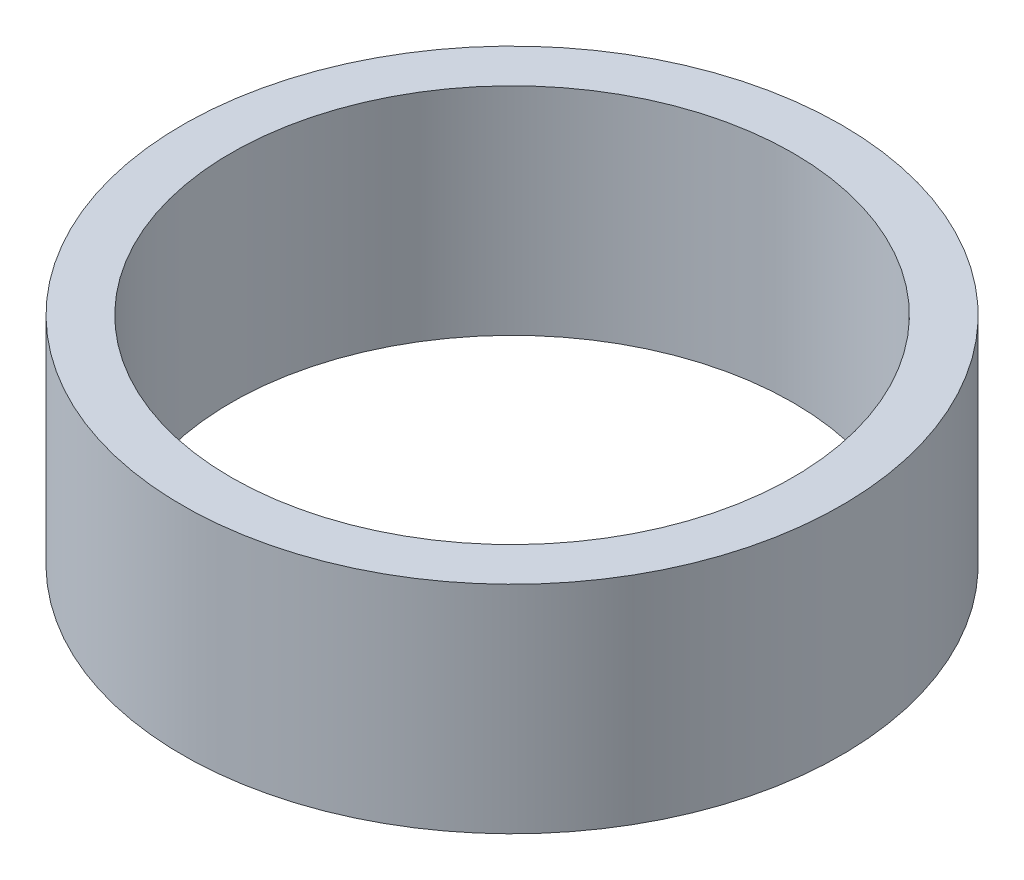
from build123d import *

# Parameters (mm, degrees)
SKETCH1_W = 1.8
SKETCH1_H = 8


with BuildPart() as part:
    # Sketch1 → Anillo (revolve)
    with BuildSketch(Plane.XY, mode=Mode.PRIVATE) as anillo_sk:
        with Locations((11.3, 0)):
            Rectangle(SKETCH1_W, SKETCH1_H)
    revolve(anillo_sk.sketch.rotate(Axis((0, -8, 0), (0, 1, 0)), 90), axis=Axis((0, -8, 0), (0, 1, 0)))


solid = part.part
